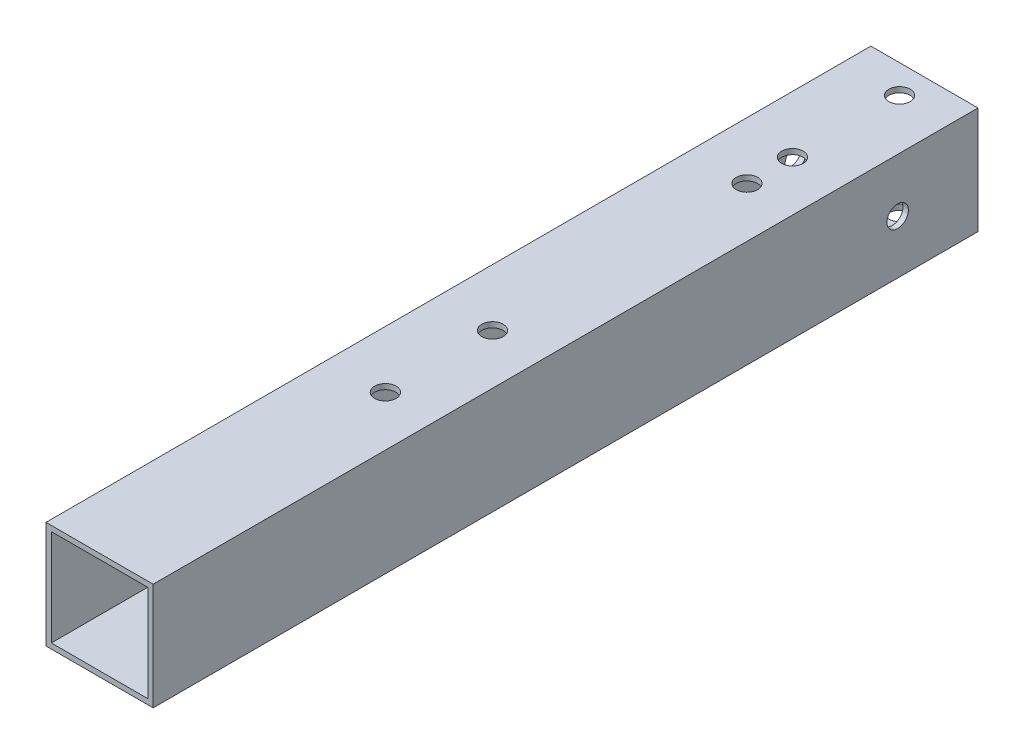
from build123d import *

# Parameters (mm, degrees)
SKETCH_1_W               = 20
SKETCH_1_H               = 20
SKETCH_1_W_2             = 18
SKETCH_1_H_2             = 18
EXTRUDE_1_DEPTH          = 83.5
CUT_EXTRUDE_2_DEPTH      = 85.689137438
CUT_EXTRUDE_2_DEPTH_BACK = 85.689137438
SKETCH_3_R               = 2
SKETCH_5_W               = 13
SKETCH_5_H               = 20
CUT_EXTRUDE_3_DEPTH      = 87.442177205
SKETCH_7_R               = 2
CUT_EXTRUDE_4_DEPTH      = 87.442177205


with BuildPart() as part:
    # 草图1 → 凸台-拉伸1 (new, symmetric)
    with BuildSketch(Plane.XY):
        Rectangle(SKETCH_1_W, SKETCH_1_H)
        Rectangle(SKETCH_1_W_2, SKETCH_1_H_2, mode=Mode.SUBTRACT)
    extrude(amount=EXTRUDE_1_DEPTH, both=True)

    # 草图3 → 切除-拉伸2 (cut, two sides: drawn at the far end of the back side and taken through both)
    with BuildSketch(Plane(origin=(0, 0, 0), x_dir=(1, 0, 0), z_dir=(0, 1, 0)).offset(-CUT_EXTRUDE_2_DEPTH_BACK)):
        with Locations(Location((0.645896247, -30.788728887, 0), (0, 0, 270))):
            Circle(SKETCH_3_R)
        with Locations(Location((0.645896247, -10.788728887, 0), (0, 0, 270))):
            Circle(SKETCH_3_R)
        with Locations(Location((0.645896247, 36.711271113, 0), (0, 0, 270))):
            Circle(SKETCH_3_R)
        with Locations(Location((0.645896247, 45.211271113, 0), (0, 0, 270))):
            Circle(SKETCH_3_R)
        with Locations(Location((0.645896247, 65.211271113, 0), (0, 0, 270))):
            Circle(SKETCH_3_R)
    extrude(amount=CUT_EXTRUDE_2_DEPTH + CUT_EXTRUDE_2_DEPTH_BACK, mode=Mode.SUBTRACT)

    # 草图5 → 切除-拉伸3 (cut, through all)
    with BuildSketch(Plane(origin=(10, 0, 0), x_dir=(0, 0, -1), z_dir=(1, 0, 0))):
        with Locations((77, 0)):
            Rectangle(SKETCH_5_W, SKETCH_5_H)
    extrude(amount=-CUT_EXTRUDE_3_DEPTH, mode=Mode.SUBTRACT)

    # 草图7 → 切除-拉伸4 (cut, through all)
    with BuildSketch(Plane(origin=(10, 0, 0), x_dir=(0, 0, -1), z_dir=(1, 0, 0))):
        with Locations(Location((55.5, 0, 0), (0, 0, 90))):
            Circle(SKETCH_7_R)
    extrude(amount=-CUT_EXTRUDE_4_DEPTH, mode=Mode.SUBTRACT)


solid = part.part
